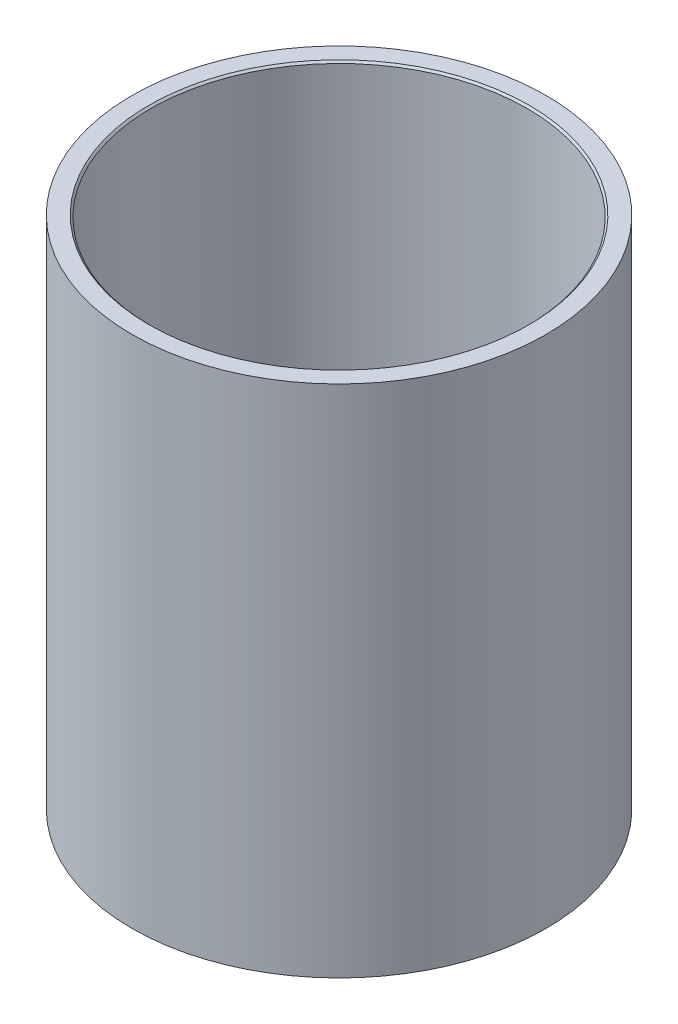
from build123d import *

# Parameters (mm, degrees)
SCHIZZO1_R                   = 33
SCHIZZO1_R_2                 = 30
ESTRUSIONE_ESTRUSIONE1_DEPTH = 82
SMUSSO1_SIZE                 = 0.3


with BuildPart() as part:
    # Schizzo1 → Estrusione-Estrusione1 (new body)
    with BuildSketch(Plane(origin=(0, 0, 0), x_dir=(1, 0, 0), z_dir=(0, 1, 0))):
        with Locations(Location((0, 0, 0), (0, 0, 270))):
            Circle(SCHIZZO1_R)
        with Locations(Location((0, 0, 0), (0, 0, 270))):
            Circle(SCHIZZO1_R_2, mode=Mode.SUBTRACT)
    extrude(amount=ESTRUSIONE_ESTRUSIONE1_DEPTH)

    # Smusso1
    smusso1_edges = [part.edges().sort_by_distance(p)[0] for p in [
        (0, 0, -30),
        (0, 82, -30),
    ]]
    chamfer(smusso1_edges, length=SMUSSO1_SIZE)


solid = part.part
